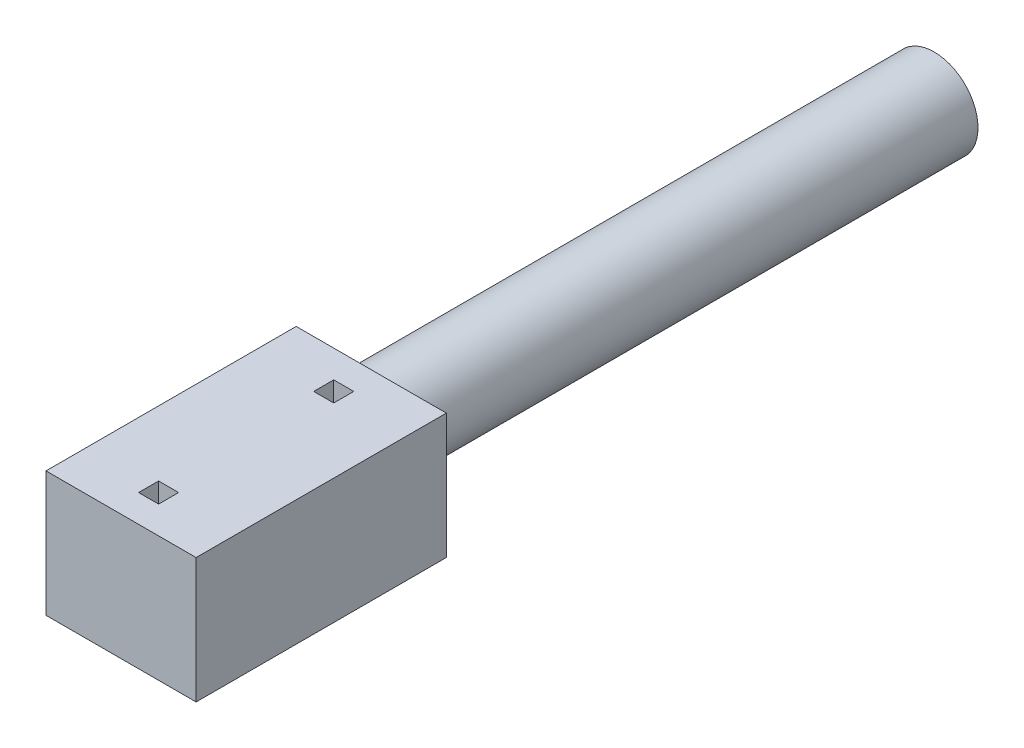
from build123d import *

# Parameters (mm, degrees)
BOSS_EXTRUDE1_START = -10
SKETCH1_W           = 12
SKETCH1_H           = 10
BOSS_EXTRUDE1_DEPTH = 20
BOSS_EXTRUDE2_START = -3.6
SKETCH2_W           = 7.2
SKETCH2_H           = 5
BOSS_EXTRUDE2_DEPTH = 7.2
BOSS_EXTRUDE3_START = -7.8
SKETCH3_W           = 1.6
SKETCH3_H           = 12
BOSS_EXTRUDE3_DEPTH = 1.6
BOSS_EXTRUDE4_START = 6.2
SKETCH4_W           = 1.6
SKETCH4_H           = 12
BOSS_EXTRUDE4_DEPTH = 1.6
BOSS_EXTRUDE5_START = -55
SKETCH5_R           = 3.5
BOSS_EXTRUDE5_DEPTH = 46


with BuildPart() as part:
    # Sketch1 → Boss-Extrude1 (new body)
    with BuildSketch(Plane.XY.offset(BOSS_EXTRUDE1_START)):
        with Locations((0, 5)):
            Rectangle(SKETCH1_W, SKETCH1_H)
    extrude(amount=BOSS_EXTRUDE1_DEPTH)


with BuildPart() as body_2:
    # Sketch2 → Boss-Extrude2 (new body)
    with BuildSketch(Plane.XY.offset(BOSS_EXTRUDE2_START)):
        with Locations((0, 1.5)):
            Rectangle(SKETCH2_W, SKETCH2_H)
    extrude(amount=BOSS_EXTRUDE2_DEPTH)


with BuildPart() as part_1:
    add(part.part)

    # Combine1: cut body 2
    add(body_2.part, mode=Mode.SUBTRACT)


with BuildPart() as body_2_2:
    # Sketch3 → Boss-Extrude3 (new body)
    with BuildSketch(Plane.XY.offset(BOSS_EXTRUDE3_START)):
        with Locations((0, 5)):
            Rectangle(SKETCH3_W, SKETCH3_H)
    extrude(amount=BOSS_EXTRUDE3_DEPTH)


with BuildPart() as part_2:
    add(part_1.part)

    # Combine2: cut body 2 2
    add(body_2_2.part, mode=Mode.SUBTRACT)


with BuildPart() as body_2_3:
    # Sketch4 → Boss-Extrude4 (new body)
    with BuildSketch(Plane.XY.offset(BOSS_EXTRUDE4_START)):
        with Locations((0, 5)):
            Rectangle(SKETCH4_W, SKETCH4_H)
    extrude(amount=BOSS_EXTRUDE4_DEPTH)


with BuildPart() as part_3:
    add(part_2.part)

    # Combine3: cut body 2 3
    add(body_2_3.part, mode=Mode.SUBTRACT)

    # Sketch5 → Boss-Extrude5 (add)
    with BuildSketch(Plane.XY.offset(BOSS_EXTRUDE5_START)):
        with Locations((0, 6)):
            Circle(SKETCH5_R)
    extrude(amount=BOSS_EXTRUDE5_DEPTH)


solid = part_3.part
